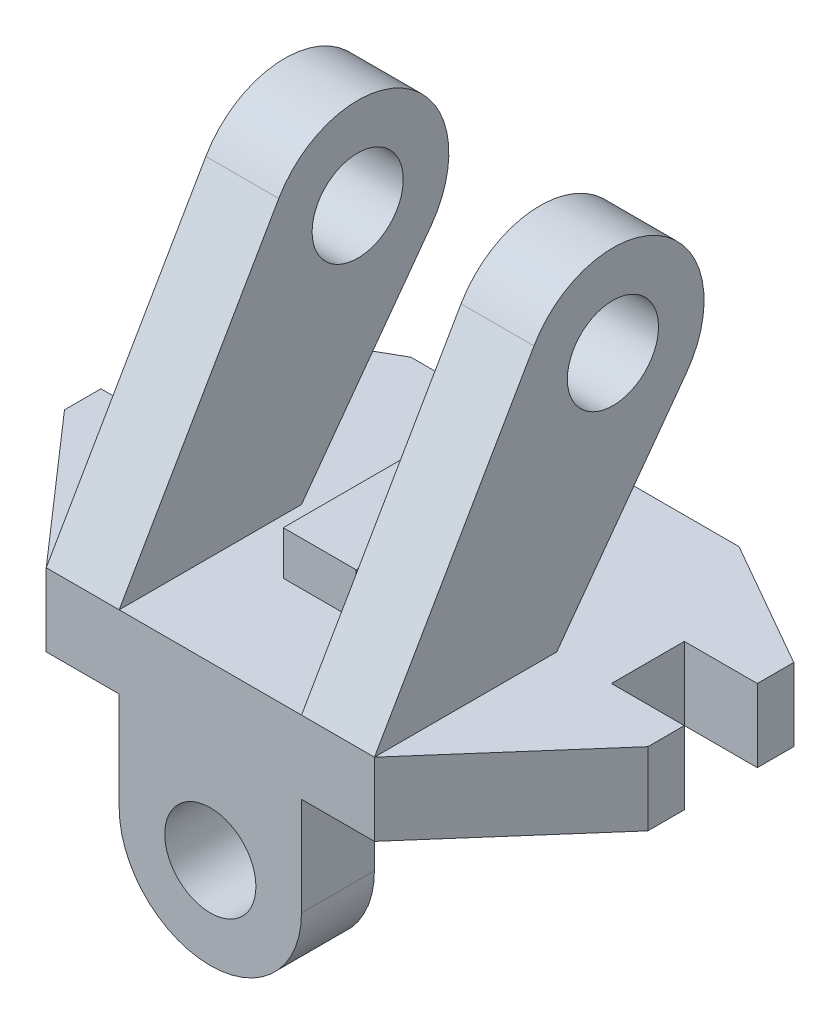
from build123d import *

# Parameters (mm, degrees)
BOSS_EXTRUDE1_DEPTH     = 100
SKETCH1_3_R             = 12.5
BOSS_EXTRUDE2_DEPTH     = 20
BOSS_EXTRUDE3_START     = -100
SKETCH1_4_W             = 20
SKETCH1_4_H             = 12
BOSS_EXTRUDE3_DEPTH     = 70
BOSS_EXTRUDE4_START     = -55
SKETCH2_R               = 12.5
BOSS_EXTRUDE4_DEPTH     = 20
BOSS_EXTRUDE5_START     = -125
SKETCH2_3_R             = 12.5
BOSS_EXTRUDE5_DEPTH     = 20
CUT_EXTRUDE1_DEPTH      = 209.315712821
CUT_EXTRUDE1_DEPTH_BACK = 209.315712821
SKETCH4_W               = 20
SKETCH4_H               = 20


with BuildPart() as part:
    # Sketch1 → Boss-Extrude1 (new body)
    with BuildSketch(Plane.XY):
        Polygon((105, 20), (125, 20), (160, 20), (160, 0), (0, 0), (0, 20), (35, 20), (55, 20), align=None)
    extrude(amount=-BOSS_EXTRUDE1_DEPTH)

    # Sketch1<3> → Boss-Extrude2 (add)
    with BuildSketch(Plane.XY):
        with BuildLine():
            Line((105, 0), (55, 0))
            Line((55, 0), (55, -27))
            ThreePointArc((55, -27), (80, -52), (105, -27))
            Line((105, -27), (105, 0))
        make_face()
        with Locations((80, -27)):
            Circle(SKETCH1_3_R, mode=Mode.SUBTRACT)
    extrude(amount=-BOSS_EXTRUDE2_DEPTH)

    # Sketch1<4> → Boss-Extrude3 (add)
    with BuildSketch(Plane.XY.offset(BOSS_EXTRUDE3_START)):
        with Locations((80, 26)):
            Rectangle(SKETCH1_4_W, SKETCH1_4_H)
    extrude(amount=BOSS_EXTRUDE3_DEPTH)

    # Sketch2 → Boss-Extrude4 (add)
    with BuildSketch(Plane.ZY.offset(BOSS_EXTRUDE4_START)):
        with BuildLine():
            Line((0, 20), (-43.758397368, 95.791767499))
            ThreePointArc((-43.758397368, 95.791767499), (-79.070979034, 104.228606226), (-85.569779349, 68.508524114))
            Line((-85.569779349, 68.508524114), (-50, 20))
            Line((-50, 20), (0, 20))
        make_face()
        with Locations((-65.409032463, 83.291767499)):
            Circle(SKETCH2_R, mode=Mode.SUBTRACT)
    extrude(amount=BOSS_EXTRUDE4_DEPTH)

    # Sketch2<3> → Boss-Extrude5 (add)
    with BuildSketch(Plane.ZY.offset(BOSS_EXTRUDE5_START)):
        with BuildLine():
            Line((0, 20), (-43.758397368, 95.791767499))
            ThreePointArc((-43.758397368, 95.791767499), (-79.070979034, 104.228606226), (-85.569779349, 68.508524114))
            Line((-85.569779349, 68.508524114), (-50, 20))
            Line((-50, 20), (0, 20))
        make_face()
        with Locations((-65.409032463, 83.291767499)):
            Circle(SKETCH2_3_R, mode=Mode.SUBTRACT)
    extrude(amount=BOSS_EXTRUDE5_DEPTH)

    # Sketch4 → Cut-Extrude1 (cut, two sides: drawn at the far end of the back side and taken through both)
    with BuildSketch(Plane(origin=(0, 20, 0), x_dir=(1, 0, 0), z_dir=(0, 1, 0)).offset(-CUT_EXTRUDE1_DEPTH_BACK)):
        Polygon((0, 100), (0, 80), (35, 100), align=None)
        Polygon((0, 0), (35, 0), (0, 40), align=None)
        Polygon((160, 40), (125, 0), (160, 0), align=None)
        Polygon((125, 100), (160, 80), (160, 100), align=None)
        with Locations((150, 60)):
            Rectangle(SKETCH4_W, SKETCH4_H)
        with Locations((10, 60)):
            Rectangle(SKETCH4_W, SKETCH4_H)
    extrude(amount=CUT_EXTRUDE1_DEPTH + CUT_EXTRUDE1_DEPTH_BACK, mode=Mode.SUBTRACT)


solid = part.part
